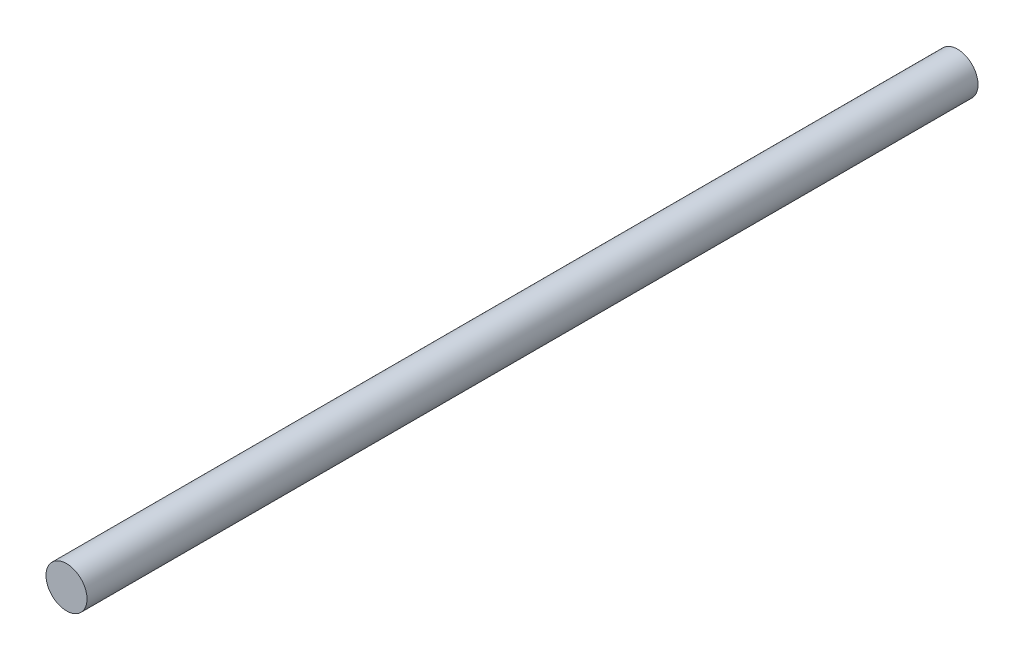
from build123d import *

# Parameters (mm, degrees)
SKETCH1_R           = 4
BOSS_EXTRUDE1_DEPTH = 173.7


with BuildPart() as part:
    # Sketch1 → Boss-Extrude1 (new body)
    with BuildSketch(Plane.XY):
        with Locations(Location((0, 0, 0), (0, 0, 180))):
            Circle(SKETCH1_R)
    extrude(amount=BOSS_EXTRUDE1_DEPTH)


solid = part.part
